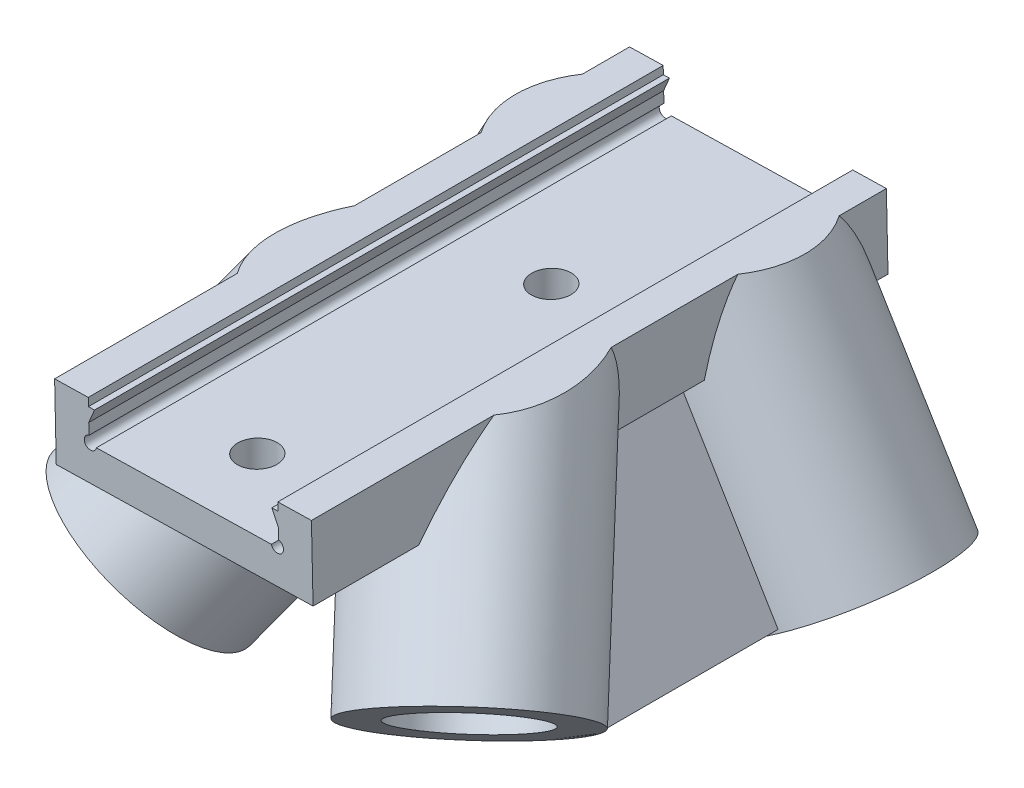
from build123d import *

# Parameters (mm, degrees)
BOSS_EXTRUDE1_DEPTH      = 25
BOSS_EXTRUDE1_DEPTH_BACK = 22
SKETCH5_R                = 8
BOSS_EXTRUDE2_DEPTH      = 30
SKETCH6_R                = 8
BOSS_EXTRUDE3_DEPTH      = 30
SKETCH18_R               = 8
BOSS_EXTRUDE4_DEPTH      = 30
SKETCH19_R               = 8
BOSS_EXTRUDE5_DEPTH      = 30
SKETCH11_R               = 0.5
CUT_EXTRUDE4_DEPTH       = 61.172763276
CUT_EXTRUDE5_REACH       = 41.594
SKETCH12_R               = 1.6
TOPCUT_DEPTH             = 61.172763276
GRABTABS_DEPTH           = 47
BOSS_EXTRUDE6_DEPTH      = 30.5
SKETCH22_R               = 5.1
CUT_EXTRUDE6_DEPTH       = 14
SKETCH23_R               = 5.1
CUT_EXTRUDE7_DEPTH       = 14
SKETCH20_R               = 5.1
CUT_EXTRUDE8_DEPTH       = 14
SKETCH21_R               = 5.1
CUT_EXTRUDE9_DEPTH       = 14


with BuildPart() as part:
    # Sketch3 → Boss-Extrude1 (new, two sides: drawn at the far end of the back side and taken through both)
    with BuildSketch(Plane(origin=(0, 0, 0), x_dir=(-0.9678879191476432, 0.2513821313618881, 0), z_dir=(0, 0, 1)).offset(-BOSS_EXTRUDE1_DEPTH_BACK)):
        Polygon((-7.234103595, -12.967950693), (12.967950693, -7.234103595), (7.234103595, 12.967950693), (-12.967950693, 7.234103595), align=None)
    extrude(amount=BOSS_EXTRUDE1_DEPTH + BOSS_EXTRUDE1_DEPTH_BACK)

    # Sketch5 → Boss-Extrude2 (add)
    with BuildSketch(Plane(origin=(0, 0, 0), x_dir=(-0.7398893525523432, -0.6222846190478576, -0.2555887299474237), z_dir=(0.4497352826512201, -0.740093355961685, 0.499999999999998))):
        with Locations(Location((0, 0, 0), (0, 0, 224.122685504))):
            Circle(SKETCH5_R)
    extrude(amount=BOSS_EXTRUDE2_DEPTH)

    # Sketch6 → Boss-Extrude3 (add)
    with BuildSketch(Plane(origin=(0, 0, 0), x_dir=(-0.7035639492311271, 0.6172392366079582, 0.3521554970945721), z_dir=(-0.4160720061092844, -0.7595288577349761, 0.499999999999998))):
        with Locations(Location((0, 0, 0), (0, 0, 322.705646398))):
            Circle(SKETCH6_R)
    extrude(amount=BOSS_EXTRUDE3_DEPTH)

    # Sketch18 → Boss-Extrude4 (add)
    with BuildSketch(Plane(origin=(0, 0, -14), x_dir=(-0.8770283809411537, 0.48043856945892555, 0), z_dir=(-0.4804385694589255, -0.8770283809411535, 0))):
        with Locations(Location((0, 0, 0), (0, 0, 61.287925102))):
            Circle(SKETCH18_R)
    extrude(amount=BOSS_EXTRUDE4_DEPTH)

    # Sketch19 → Boss-Extrude5 (add)
    with BuildSketch(Plane(origin=(0, 0, -14), x_dir=(-0.8545861965798597, -0.5193095730055144, 0), z_dir=(0.5193095730055143, -0.8545861965798596, 0))):
        with Locations(Location((0, 0, 0), (0, 0, 48.985500334))):
            Circle(SKETCH19_R)
    extrude(amount=BOSS_EXTRUDE5_DEPTH)

    # Sketch11 → Cut-Extrude4 (cut, through all)
    with BuildSketch(Plane(origin=(0, 0, 25), x_dir=(0.967887919147643, -0.25138213136188803, 0), z_dir=(0, 0, 1))):
        with BuildLine():
            ThreePointArc((-4.766381934, -9.44058657), (-4.766628372, -9.424890171), (-4.767367442, -9.409209245))
            Line((-4.767367442, -9.409209245), (-5.339457415, -9.571582654))
            Line((-5.339457415, -9.571582654), (-5.501830825, -8.999492681))
            ThreePointArc((-5.501830825, -8.999492681), (-5.523554594, -9.869378155), (-4.766381934, -9.44058657))
        make_face()
        with BuildLine():
            Line((-5.339457415, -9.571582654), (-4.767367442, -9.409209245))
            ThreePointArc((-4.767367442, -9.409209245), (-5.022796995, -9.003932957), (-5.501830825, -8.999492681))
            Line((-5.501830825, -8.999492681), (-5.339457415, -9.571582654))
        make_face()
        with BuildLine():
            Line((8.999492681, -5.501830825), (9.571582654, -5.339457415))
            Line((9.571582654, -5.339457415), (9.409209245, -4.767367442))
            ThreePointArc((9.409209245, -4.767367442), (9.003932957, -5.022796995), (8.999492681, -5.501830825))
        make_face()
        with BuildLine():
            Line((9.409209245, -4.767367442), (9.571582654, -5.339457415))
            Line((9.571582654, -5.339457415), (8.999492681, -5.501830825))
            ThreePointArc((8.999492681, -5.501830825), (9.561939475, -5.751431903), (9.94058657, -5.266381934))
            ThreePointArc((9.94058657, -5.266381934), (9.782866673, -4.901903771), (9.409209245, -4.767367442))
        make_face()
        with Locations((-5.266381934, -9.44058657)):
            Circle(SKETCH11_R)
        with Locations((9.44058657, -5.266381934)):
            Circle(SKETCH11_R)
        Polygon((-5.339457415, -9.571582654), (9.571582654, -5.339457415), (5.339457415, 9.571582654), (-9.571582654, 5.339457415), align=None)
    extrude(amount=-CUT_EXTRUDE4_DEPTH, mode=Mode.SUBTRACT)

    # Sketch12 → Cut-Extrude5 (cut, up to next)
    with BuildSketch(Plane(origin=(0.235642936, -10.497355496, 0), x_dir=(0.07428415697149086, 0.0016675187230335104, -0.9972357210832067), z_dir=(-0.02244218436129408, 0.9997481424644377, 0)), mode=Mode.PRIVATE) as cut_extrude5_sk1:
        with Locations(Location((-18.947478701, -1.411754543, 0), (0, 0, 274.261167974))):
            Circle(SKETCH12_R)
    cut_extrude5_tool1 = extrude(cut_extrude5_sk1.sketch, amount=CUT_EXTRUDE5_REACH, mode=Mode.PRIVATE) & part.part
    # Sketch12 → Cut-Extrude5 (cut, up to next)
    with BuildSketch(Plane(origin=(0.235642936, -10.497355496, 0), x_dir=(0.07428415697149086, 0.0016675187230335104, -0.9972357210832067), z_dir=(-0.02244218436129408, 0.9997481424644377, 0)), mode=Mode.PRIVATE) as cut_extrude5_sk2:
        with Locations(Location((5.019164388, 0.373972086, 0), (0, 0, 274.261167974))):
            Circle(SKETCH12_R)
    cut_extrude5_tool2 = extrude(cut_extrude5_sk2.sketch, amount=CUT_EXTRUDE5_REACH, mode=Mode.PRIVATE) & part.part
    add(cut_extrude5_tool1.solids().sort_by_distance((0.235643, -10.497355, 19))[0], mode=Mode.SUBTRACT)
    add(cut_extrude5_tool2.solids().sort_by_distance((0.235643, -10.497355, -5.033077))[0], mode=Mode.SUBTRACT)

    # Sketch14 → TopCut (cut, through all)
    with BuildSketch(Plane.XY.offset(25)):
        Polygon((-31.105779731, -5.199391149), (38.352697692, -3.640198499), (37.988721129, 12.574127466), (-33.745248602, 10.963854933), align=None)
    extrude(amount=-TOPCUT_DEPTH, mode=Mode.SUBTRACT)

    # Sketch17 → GrabTabs (add, through all)
    with BuildSketch(Plane(origin=(0, 0, 25), x_dir=(-1, 0, 0), z_dir=(0, 0, -1))):
        Polygon((7.132596783, -5.31140877), (7.607527123, -6.433816222), (7.632470855, -5.322629862), align=None)
        Polygon((-7.888569085, -6.085962364), (-7.363751282, -4.985997097), (-7.863625354, -4.974776005), align=None)
    extrude(amount=GRABTABS_DEPTH)

    # Sketch24 → Boss-Extrude6 (add)
    with BuildSketch(Plane(origin=(0, 0, -22), x_dir=(-1, 0, 0), z_dir=(0, 0, -1))):
        Polygon((-13.818067506, -26.398167405), (-17.409683037, -24.238344439), (-7.909513608, -8.440310713), (-4.317898077, -10.60013368), align=None)
        Polygon((3.837888164, -10.783213448), (7.522803724, -8.786732873), (16.304497418, -24.9951549), (12.619581859, -26.991635476), align=None)
    extrude(amount=-BOSS_EXTRUDE6_DEPTH)

    # Sketch22 → Cut-Extrude6 (cut)
    with BuildSketch(Plane(origin=(-14.413157084, -26.310851428, 0), x_dir=(0.8770283809411535, -0.48043856945892577, 0), z_dir=(-0.4804385694589257, -0.8770283809411534, 0))):
        with Locations((0, -14)):
            Circle(SKETCH22_R)
    extrude(amount=-CUT_EXTRUDE6_DEPTH, mode=Mode.SUBTRACT)

    # Sketch23 → Cut-Extrude7 (cut)
    with BuildSketch(Plane(origin=(-12.482160183, -22.785865732, 15), x_dir=(0.9093316698170122, -0.34752852674676815, 0.22877901425835656), z_dir=(-0.41607200610928446, -0.7595288577349762, 0.4999999999999979))):
        with Locations(Location((0, 0, 0), (0, 0, 270))):
            Circle(SKETCH23_R)
    extrude(amount=-CUT_EXTRUDE7_DEPTH, mode=Mode.SUBTRACT)

    # Sketch20 → Cut-Extrude8 (cut)
    with BuildSketch(Plane(origin=(13.49205848, -22.202800679, 15), x_dir=(-0.893161897719908, -0.37266042750079065, 0.2517658242023739), z_dir=(0.44973528265122, -0.7400933559616851, 0.49999999999999784))):
        with Locations(Location((0, 0, 0), (0, 0, 90))):
            Circle(SKETCH20_R)
    extrude(amount=-CUT_EXTRUDE8_DEPTH, mode=Mode.SUBTRACT)

    # Sketch21 → Cut-Extrude9 (cut)
    with BuildSketch(Plane(origin=(15.57928719, -25.637585897, 0), x_dir=(0.8545861965798595, 0.5193095730055145, 0), z_dir=(0.5193095730055145, -0.8545861965798595, 0))):
        with Locations((0, -14)):
            Circle(SKETCH21_R)
    extrude(amount=-CUT_EXTRUDE9_DEPTH, mode=Mode.SUBTRACT)


solid = part.part
